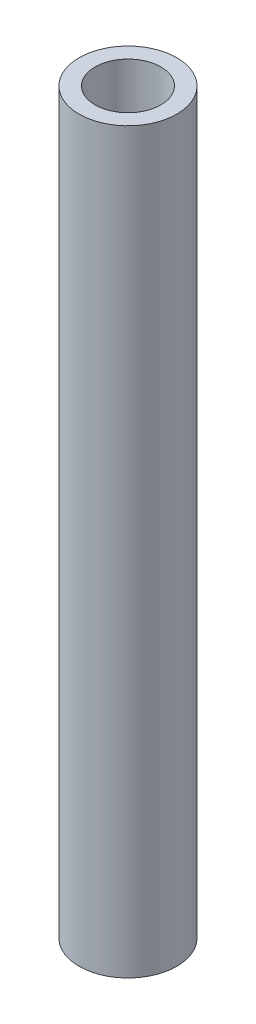
from build123d import *

# Parameters (mm, degrees)
SKETCH_1_R      = 2.45
SKETCH_1_R_2    = 1.65
EXTRUDE_1_DEPTH = 18.5


with BuildPart() as part:
    # Эскиз1 → Бобышка-Вытянуть1 (new, symmetric)
    with BuildSketch(Plane(origin=(0, 0, 0), x_dir=(1, 0, 0), z_dir=(0, 1, 0))):
        with Locations(Location((0, 0, 0), (0, 0, 270))):
            Circle(SKETCH_1_R)
        with Locations(Location((0, 0, 0), (0, 0, 270))):
            Circle(SKETCH_1_R_2, mode=Mode.SUBTRACT)
    extrude(amount=EXTRUDE_1_DEPTH, both=True)


solid = part.part
